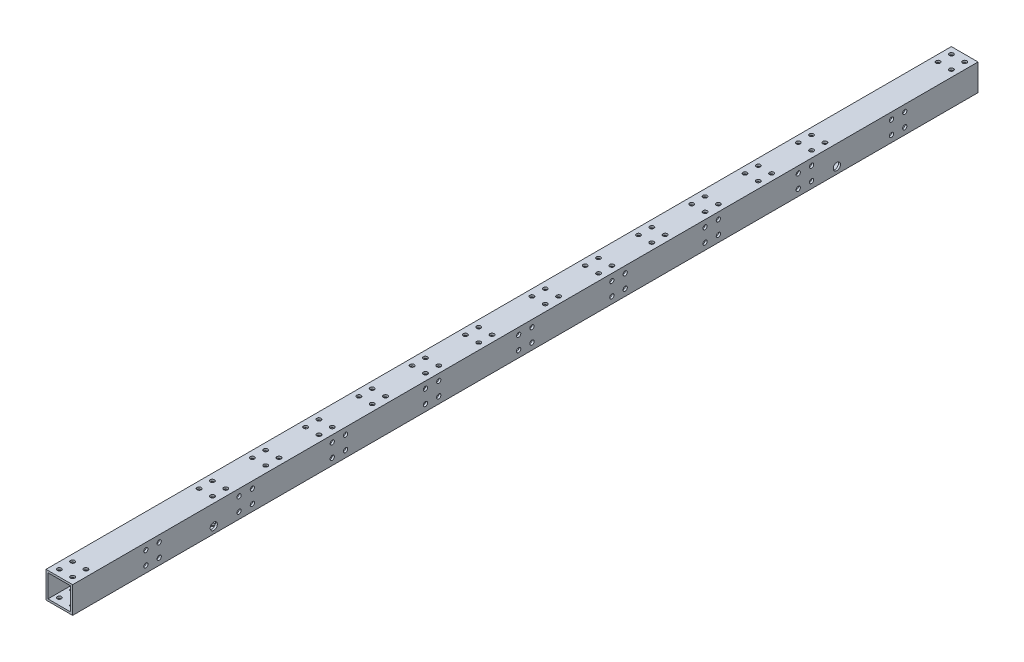
from build123d import *

# Parameters (mm, degrees)
SKETCH_1_W          = 20
SKETCH_1_H          = 20
SKETCH_1_W_2        = 17
SKETCH_1_H_2        = 17
EXTRUDE_1_DEPTH     = 680
SKETCH_2_R          = 1.575
CUT_EXTRUDE_1_DEPTH = 681.587981087
SKETCH_3_R          = 2.7
SKETCH_3_R_2        = 1.6
CUT_EXTRUDE_2_DEPTH = 681.587981087


with BuildPart() as part:
    # 草图1 → 拉伸-薄壁1 (new body)
    with BuildSketch(Plane.XY):
        with Locations((10, -10)):
            Rectangle(SKETCH_1_W, SKETCH_1_H)
        with Locations((10, -10)):
            Rectangle(SKETCH_1_W_2, SKETCH_1_H_2, mode=Mode.SUBTRACT)
    extrude(amount=EXTRUDE_1_DEPTH)

    # 草图2 → 切除-拉伸1 (cut, through all)
    with BuildSketch(Plane(origin=(0, 0, 0), x_dir=(1, 0, 0), z_dir=(0, 1, 0))):
        with Locations(Location((5, -5, 0), (0, 0, 270))):
            Circle(SKETCH_2_R)
        with Locations(Location((15, -5, 0), (0, 0, 90))):
            Circle(SKETCH_2_R)
        with Locations(Location((15, -675, 0), (0, 0, 270))):
            Circle(SKETCH_2_R)
        with Locations(Location((5, -675, 0), (0, 0, 90))):
            Circle(SKETCH_2_R)
        with Locations(Location((15, -15, 0), (0, 0, 270))):
            Circle(SKETCH_2_R)
        with Locations(Location((5, -15, 0), (0, 0, 90))):
            Circle(SKETCH_2_R)
        with Locations(Location((5, -665, 0), (0, 0, 270))):
            Circle(SKETCH_2_R)
        with Locations(Location((15, -665, 0), (0, 0, 90))):
            Circle(SKETCH_2_R)
        with Locations(Location((5, -450, 0), (0, 0, 270))):
            Circle(SKETCH_2_R)
        with Locations(Location((15, -450, 0), (0, 0, 90))):
            Circle(SKETCH_2_R)
        with Locations(Location((15, -440, 0), (0, 0, 270))):
            Circle(SKETCH_2_R)
        with Locations(Location((5, -440, 0), (0, 0, 90))):
            Circle(SKETCH_2_R)
        with Locations(Location((5, -240, 0), (0, 0, 270))):
            Circle(SKETCH_2_R)
        with Locations(Location((15, -240, 0), (0, 0, 90))):
            Circle(SKETCH_2_R)
        with Locations(Location((15, -230, 0), (0, 0, 270))):
            Circle(SKETCH_2_R)
        with Locations(Location((5, -230, 0), (0, 0, 90))):
            Circle(SKETCH_2_R)
        with Locations(Location((5, -490, 0), (0, 0, 270))):
            Circle(SKETCH_2_R)
        with Locations(Location((15, -490, 0), (0, 0, 90))):
            Circle(SKETCH_2_R)
        with Locations(Location((15, -480, 0), (0, 0, 270))):
            Circle(SKETCH_2_R)
        with Locations(Location((5, -480, 0), (0, 0, 90))):
            Circle(SKETCH_2_R)
        with Locations(Location((5, -200, 0), (0, 0, 270))):
            Circle(SKETCH_2_R)
        with Locations(Location((15, -200, 0), (0, 0, 90))):
            Circle(SKETCH_2_R)
        with Locations(Location((15, -190, 0), (0, 0, 270))):
            Circle(SKETCH_2_R)
        with Locations(Location((5, -190, 0), (0, 0, 90))):
            Circle(SKETCH_2_R)
        with Locations(Location((5, -270, 0), (0, 0, 90))):
            Circle(SKETCH_2_R)
        with Locations(Location((15, -270, 0), (0, 0, 270))):
            Circle(SKETCH_2_R)
        with Locations(Location((5, -280, 0), (0, 0, 270))):
            Circle(SKETCH_2_R)
        with Locations(Location((15, -280, 0), (0, 0, 90))):
            Circle(SKETCH_2_R)
        with Locations(Location((5, -310, 0), (0, 0, 90))):
            Circle(SKETCH_2_R)
        with Locations(Location((5, -320, 0), (0, 0, 270))):
            Circle(SKETCH_2_R)
        with Locations(Location((15, -310, 0), (0, 0, 270))):
            Circle(SKETCH_2_R)
        with Locations(Location((15, -320, 0), (0, 0, 90))):
            Circle(SKETCH_2_R)
        with Locations(Location((15, -360, 0), (0, 0, 270))):
            Circle(SKETCH_2_R)
        with Locations(Location((15, -370, 0), (0, 0, 90))):
            Circle(SKETCH_2_R)
        with Locations(Location((5, -360, 0), (0, 0, 90))):
            Circle(SKETCH_2_R)
        with Locations(Location((5, -370, 0), (0, 0, 270))):
            Circle(SKETCH_2_R)
        with Locations(Location((15, -400, 0), (0, 0, 270))):
            Circle(SKETCH_2_R)
        with Locations(Location((5, -400, 0), (0, 0, 90))):
            Circle(SKETCH_2_R)
        with Locations(Location((15, -410, 0), (0, 0, 90))):
            Circle(SKETCH_2_R)
        with Locations(Location((5, -410, 0), (0, 0, 270))):
            Circle(SKETCH_2_R)
        with Locations(Location((15, -110, 0), (0, 0, 270))):
            Circle(SKETCH_2_R)
        with Locations(Location((15, -120, 0), (0, 0, 90))):
            Circle(SKETCH_2_R)
        with Locations(Location((5, -110, 0), (0, 0, 90))):
            Circle(SKETCH_2_R)
        with Locations(Location((5, -120, 0), (0, 0, 270))):
            Circle(SKETCH_2_R)
        with Locations(Location((15, -150, 0), (0, 0, 270))):
            Circle(SKETCH_2_R)
        with Locations(Location((5, -150, 0), (0, 0, 90))):
            Circle(SKETCH_2_R)
        with Locations(Location((15, -160, 0), (0, 0, 90))):
            Circle(SKETCH_2_R)
        with Locations(Location((5, -160, 0), (0, 0, 270))):
            Circle(SKETCH_2_R)
        with Locations(Location((5, -520, 0), (0, 0, 90))):
            Circle(SKETCH_2_R)
        with Locations(Location((15, -520, 0), (0, 0, 270))):
            Circle(SKETCH_2_R)
        with Locations(Location((5, -530, 0), (0, 0, 270))):
            Circle(SKETCH_2_R)
        with Locations(Location((15, -530, 0), (0, 0, 90))):
            Circle(SKETCH_2_R)
        with Locations(Location((5, -560, 0), (0, 0, 90))):
            Circle(SKETCH_2_R)
        with Locations(Location((5, -570, 0), (0, 0, 270))):
            Circle(SKETCH_2_R)
        with Locations(Location((15, -560, 0), (0, 0, 270))):
            Circle(SKETCH_2_R)
        with Locations(Location((15, -570, 0), (0, 0, 90))):
            Circle(SKETCH_2_R)
    extrude(amount=-CUT_EXTRUDE_1_DEPTH, mode=Mode.SUBTRACT)

    # 草图3 → 切除-拉伸2 (cut, through all)
    with BuildSketch(Plane.ZY):
        with Locations(Location((106, -15, 0), (0, 0, 270))):
            Circle(SKETCH_3_R)
        with Locations((574, -15)):
            Circle(SKETCH_3_R)
        with Locations(Location((335, -5, 0), (0, 0, 270))):
            Circle(SKETCH_3_R_2)
        with Locations((335, -15)):
            Circle(SKETCH_3_R_2)
        with Locations(Location((345, -15, 0), (0, 0, 270))):
            Circle(SKETCH_3_R_2)
        with Locations((345, -5)):
            Circle(SKETCH_3_R_2)
        with Locations(Location((265, -5, 0), (0, 0, 270))):
            Circle(SKETCH_3_R_2)
        with Locations((275, -5)):
            Circle(SKETCH_3_R_2)
        with Locations((265, -15)):
            Circle(SKETCH_3_R_2)
        with Locations(Location((275, -15, 0), (0, 0, 270))):
            Circle(SKETCH_3_R_2)
        with Locations(Location((195, -5, 0), (0, 0, 270))):
            Circle(SKETCH_3_R_2)
        with Locations((205, -5)):
            Circle(SKETCH_3_R_2)
        with Locations((195, -15)):
            Circle(SKETCH_3_R_2)
        with Locations(Location((205, -15, 0), (0, 0, 270))):
            Circle(SKETCH_3_R_2)
        with Locations(Location((125, -5, 0), (0, 0, 270))):
            Circle(SKETCH_3_R_2)
        with Locations((135, -5)):
            Circle(SKETCH_3_R_2)
        with Locations((125, -15)):
            Circle(SKETCH_3_R_2)
        with Locations(Location((135, -15, 0), (0, 0, 270))):
            Circle(SKETCH_3_R_2)
        with Locations(Location((55, -5, 0), (0, 0, 270))):
            Circle(SKETCH_3_R_2)
        with Locations((65, -5)):
            Circle(SKETCH_3_R_2)
        with Locations((55, -15)):
            Circle(SKETCH_3_R_2)
        with Locations(Location((65, -15, 0), (0, 0, 270))):
            Circle(SKETCH_3_R_2)
        with Locations((615, -15)):
            Circle(SKETCH_3_R_2)
        with Locations(Location((625, -15, 0), (0, 0, 270))):
            Circle(SKETCH_3_R_2)
        with Locations(Location((615, -5, 0), (0, 0, 270))):
            Circle(SKETCH_3_R_2)
        with Locations((625, -5)):
            Circle(SKETCH_3_R_2)
        with Locations((545, -15)):
            Circle(SKETCH_3_R_2)
        with Locations(Location((555, -15, 0), (0, 0, 270))):
            Circle(SKETCH_3_R_2)
        with Locations(Location((545, -5, 0), (0, 0, 270))):
            Circle(SKETCH_3_R_2)
        with Locations((555, -5)):
            Circle(SKETCH_3_R_2)
        with Locations((475, -15)):
            Circle(SKETCH_3_R_2)
        with Locations(Location((485, -15, 0), (0, 0, 270))):
            Circle(SKETCH_3_R_2)
        with Locations(Location((475, -5, 0), (0, 0, 270))):
            Circle(SKETCH_3_R_2)
        with Locations((485, -5)):
            Circle(SKETCH_3_R_2)
        with Locations((405, -15)):
            Circle(SKETCH_3_R_2)
        with Locations(Location((415, -15, 0), (0, 0, 270))):
            Circle(SKETCH_3_R_2)
        with Locations(Location((405, -5, 0), (0, 0, 270))):
            Circle(SKETCH_3_R_2)
        with Locations((415, -5)):
            Circle(SKETCH_3_R_2)
    extrude(amount=-CUT_EXTRUDE_2_DEPTH, mode=Mode.SUBTRACT)


solid = part.part
